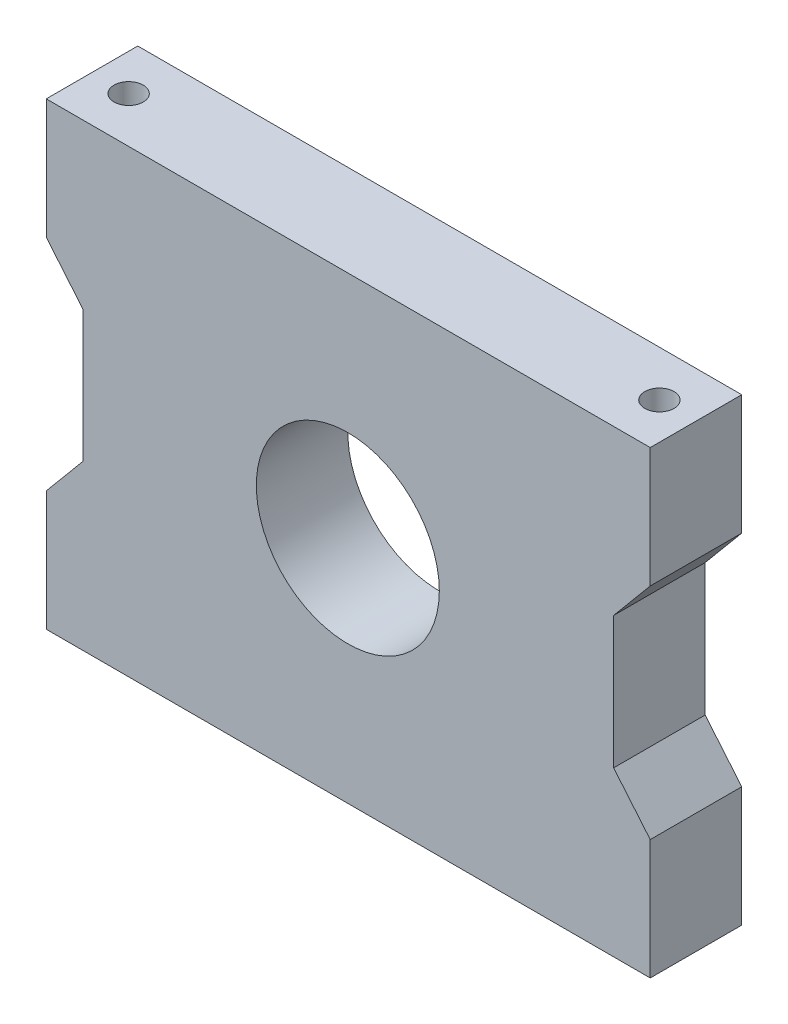
from build123d import *

# Parameters (mm, degrees)
SZKIC1_R                    = 10
DODANIE_WYCI_GNI_CIE1_DEPTH = 10
SZKIC2_R                    = 1.6
WYTNIJ_WYCI_GNI_CIE1_DEPTH  = 10


with BuildPart() as part:
    # Szkic1 → Dodanie-wyciągnięcie1 (new body)
    with BuildSketch(Plane.XY):
        Polygon((0, 0), (66, 0), (66, 13.1), (62, 17.886908539), (62, 32.313091461), (66, 37.1), (66, 50.2), (0, 50.2), (0, 37.1), (4, 32.313091461), (4, 17.886908539), (0, 13.1), align=None)
        with Locations((32.952408039, 25.1)):
            Circle(SZKIC1_R, mode=Mode.SUBTRACT)
    extrude(amount=DODANIE_WYCI_GNI_CIE1_DEPTH)

    # Szkic2 → Wytnij-wyciągnięcie1 (cut)
    with BuildSketch(Plane(origin=(0, 50.2, 0), x_dir=(1, 0, 0), z_dir=(0, 1, 0))):
        with Locations(Location((4, -5, 0), (0, 0, 270))):
            Circle(SZKIC2_R)
        with Locations(Location((62, -5, 0), (0, 0, 90))):
            Circle(SZKIC2_R)
    wytnij_wyci_gni_cie1 = extrude(amount=-WYTNIJ_WYCI_GNI_CIE1_DEPTH, mode=Mode.SUBTRACT)

    # Lustro1: Wytnij-wyciągnięcie1 across plane
    add(wytnij_wyci_gni_cie1.mirror(Plane.ZX.offset(25.1)), mode=Mode.SUBTRACT)


solid = part.part
